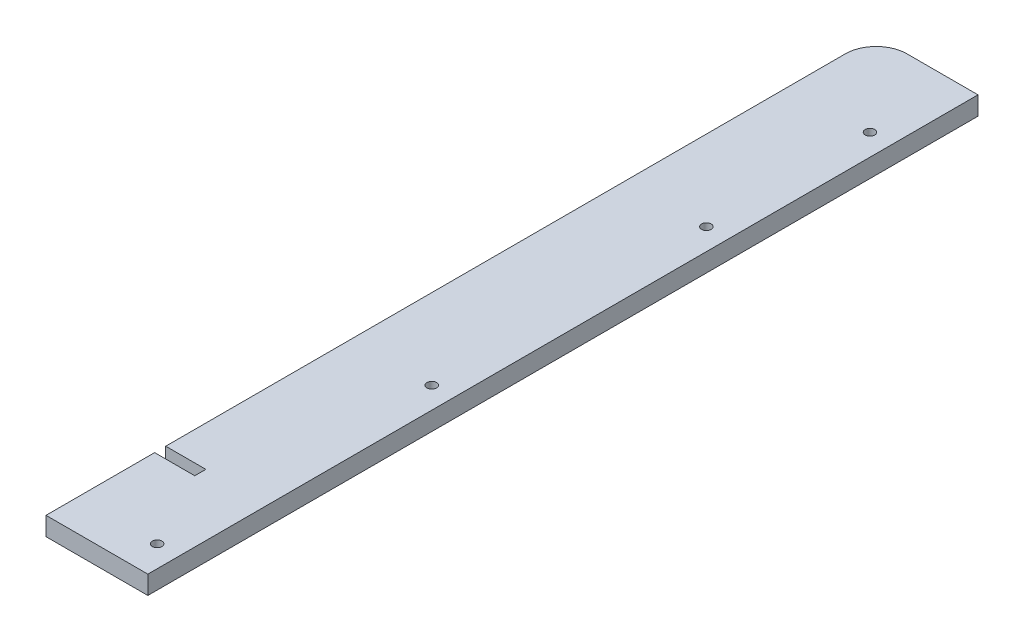
from build123d import *

# Parameters (mm, degrees)
SZKIC2_W                    = 287
SZKIC2_H                    = 852
DODANIE_WYCI_GNI_CIE1_DEPTH = 6
WYTNIJ_WYCI_GNI_CIE1_DEPTH  = 10
SZKIC5_OUTSIDE_W            = 1033.812
SZKIC5_OUTSIDE_H            = 468.812
SZKIC5_OUTSIDE_W_2          = 20
SZKIC5_OUTSIDE_H_2          = 287
WYTNIJ_WYCI_GNI_CIE3_DEPTH  = 718.686874591
PRZENIE_CIAN_1_BY           = 13
SZKIC6_W                    = 33
SZKIC6_H                    = 18
WYTNIJ_WYCI_GNI_CIE4_DEPTH  = 10
WYTNIJ_WYCI_GNI_CIE6_DEPTH  = 239.591606015
SZKIC9_R                    = 1.55
WYTNIJ_WYCI_GNI_CIE7_DEPTH  = 10
SZKIC11_W                   = 13
SZKIC11_H                   = 3.6
WYTNIJ_WYCI_GNI_CIE8_DEPTH  = 10


with BuildPart() as part:
    # Szkic2 → Dodanie-wyciągnięcie1 (new body)
    with BuildSketch(Plane.ZX.offset(1505.947389818)):
        with Locations((-40.455224703, 267.685033185)):
            Rectangle(SZKIC2_W, SZKIC2_H)
    extrude(amount=DODANIE_WYCI_GNI_CIE1_DEPTH)

    # Szkic3 → Wytnij-wyciągnięcie1 (cut)
    with BuildSketch(Plane(origin=(0, 1511.947389818, 0), x_dir=(1, 0, 0), z_dir=(0, 1, 0))):
        with BuildLine():
            Line((673.685033185, -73.044775297), (673.685033185, 153.955224703))
            ThreePointArc((673.685033185, 153.955224703), (670.756100997, 161.026292515), (663.685033185, 163.955224703))
            Line((663.685033185, 163.955224703), (-128.314966815, 163.955224703))
            ThreePointArc((-128.314966815, 163.955224703), (-135.386034627, 161.026292515), (-138.314966815, 153.955224703))
            Line((-138.314966815, 153.955224703), (-138.314966815, -73.044775297))
            ThreePointArc((-138.314966815, -73.044775297), (-135.386034627, -80.115843109), (-128.314966815, -83.044775297))
            Line((-128.314966815, -83.044775297), (663.685033185, -83.044775297))
            ThreePointArc((663.685033185, -83.044775297), (670.756100997, -80.115843109), (673.685033185, -73.044775297))
        make_face()
    extrude(amount=-WYTNIJ_WYCI_GNI_CIE1_DEPTH, mode=Mode.SUBTRACT)

    # Szkic5 outside → Wytnij-wyciągnięcie3 (cut, through all)
    with BuildSketch(Plane(origin=(0, 1511.947389818, 0), x_dir=(1, 0, 0), z_dir=(0, 1, 0))):
        with Locations((267.685, 40.455)):
            Rectangle(SZKIC5_OUTSIDE_W, SZKIC5_OUTSIDE_H)
        with Locations((-148.314966815, 40.455224703)):
            Rectangle(SZKIC5_OUTSIDE_W_2, SZKIC5_OUTSIDE_H_2, mode=Mode.SUBTRACT)
    extrude(amount=-WYTNIJ_WYCI_GNI_CIE3_DEPTH, mode=Mode.SUBTRACT)

    # Przenieś ścianę1: a face moved outward by 13.0
    extrude(part.faces().sort_by_distance((-158.314966815, 1508.947389818, -40.455224703))[0], amount=PRZENIE_CIAN_1_BY, dir=(-1, 0, 0))

    # Szkic6 → Wytnij-wyciągnięcie4 (cut)
    with BuildSketch(Plane(origin=(0, 1511.947389818, 0), x_dir=(1, 0, 0), z_dir=(0, 1, 0))):
        with Locations((-154.814966815, 174.955224703)):
            Rectangle(SZKIC6_W, SZKIC6_H)
    extrude(amount=-WYTNIJ_WYCI_GNI_CIE4_DEPTH, mode=Mode.SUBTRACT)

    # Szkic8 → Wytnij-wyciągnięcie6 (cut, through all)
    with BuildSketch(Plane.XZ.offset(-1505.947389818)):
        with BuildLine():
            Line((-161.314966815, -165.955224703), (-171.314966815, -165.955224703))
            Line((-171.314966815, -165.955224703), (-171.314966815, -155.955224703))
            ThreePointArc((-171.314966815, -155.955224703), (-168.386034627, -163.026292515), (-161.314966815, -165.955224703))
        make_face()
    extrude(amount=-WYTNIJ_WYCI_GNI_CIE6_DEPTH, mode=Mode.SUBTRACT)

    # Szkic9 → Wytnij-wyciągnięcie7 (cut)
    with BuildSketch(Plane(origin=(0, 1511.947389818, 0), x_dir=(1, 0, 0), z_dir=(0, 1, 0))):
        with Locations(Location((-145.314966815, -93.044775297, 0), (0, 0, 270))):
            Circle(SZKIC9_R)
        with Locations(Location((-145.314966815, -4.044775297, 0), (0, 0, 270))):
            Circle(SZKIC9_R)
        with Locations(Location((-145.314966815, 84.955224703, 0), (0, 0, 270))):
            Circle(SZKIC9_R)
        with Locations(Location((-145.314966815, 137.955224703, 0), (0, 0, 270))):
            Circle(SZKIC9_R)
        with Locations((-145.314966815, 173.955224703)):
            Circle(SZKIC9_R)
    extrude(amount=-WYTNIJ_WYCI_GNI_CIE7_DEPTH, mode=Mode.SUBTRACT)

    # Szkic11 → Wytnij-wyciągnięcie8 (cut)
    with BuildSketch(Plane(origin=(0, 1511.947389818, 0), x_dir=(1, 0, 0), z_dir=(0, 1, 0))):
        with Locations((-164.814966815, -66.044775297)):
            Rectangle(SZKIC11_W, SZKIC11_H)
    extrude(amount=-WYTNIJ_WYCI_GNI_CIE8_DEPTH, mode=Mode.SUBTRACT)


solid = part.part
